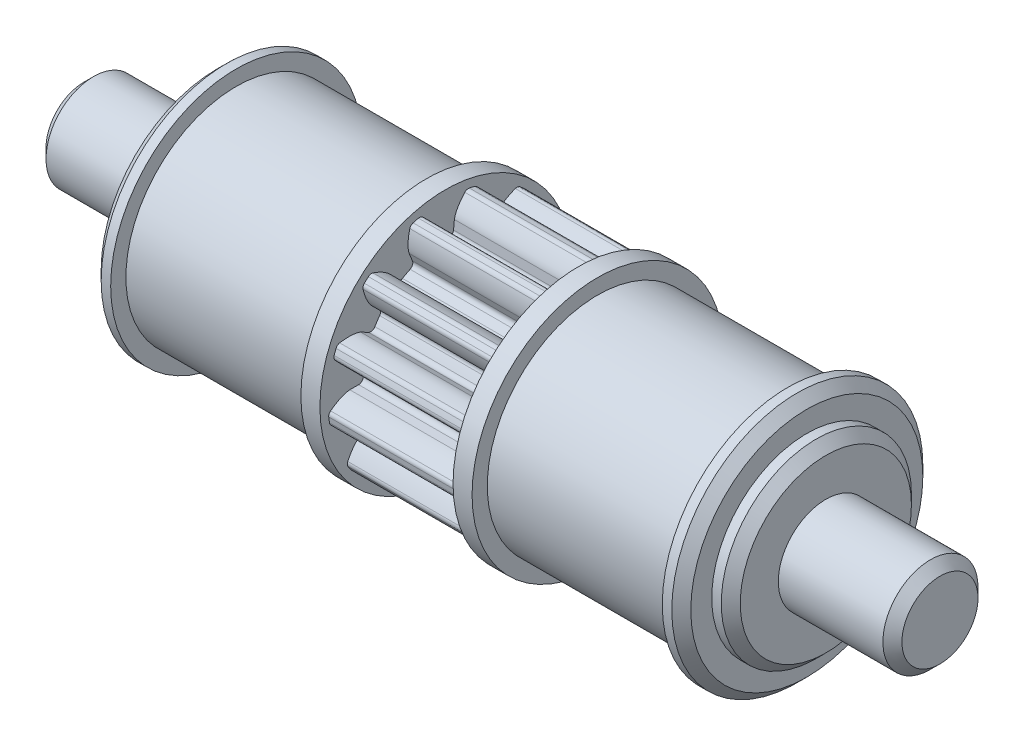
from build123d import *

# Parameters (mm, degrees)
SKETCH2_R                 = 6.173076923
BOSS_EXTRUDE1_DEPTH       = 3.5
CUT_EXTRUDE1_DEPTH        = 12.189895326
CIRPATTERN9_COUNT         = 13
CIRPATTERN9_COPY_1_DEPTH  = 12.189895326
CIRPATTERN9_COPY_2_DEPTH  = 12.189895326
CIRPATTERN9_COPY_3_DEPTH  = 12.189895326
CIRPATTERN9_COPY_4_DEPTH  = 12.189895326
CIRPATTERN9_COPY_5_DEPTH  = 12.189895326
CIRPATTERN9_COPY_6_DEPTH  = 12.189895326
CIRPATTERN9_COPY_7_DEPTH  = 12.189895326
CIRPATTERN9_COPY_8_DEPTH  = 12.189895326
CIRPATTERN9_COPY_9_DEPTH  = 12.189895326
CIRPATTERN9_COPY_10_DEPTH = 12.189895326
CIRPATTERN9_COPY_11_DEPTH = 12.189895326
CIRPATTERN9_COPY_12_DEPTH = 12.189895326
FILLET2_R                 = 0.25
CHAMFER1_SIZE             = 0.5


with BuildPart() as part:
    # Sketch2 → Boss-Extrude1 (new, symmetric)
    with BuildSketch(Plane(origin=(0, 0, 0), x_dir=(0, -1, 0), z_dir=(1, 0, 0))):
        with Locations(Location((0, 0, 0), (0, 0, 90))):
            Circle(SKETCH2_R)
    extrude(amount=BOSS_EXTRUDE1_DEPTH, both=True)

    # Sketch3 → Cut-Extrude1 (cut, through all)
    with BuildSketch(Plane(origin=(3.5, 0, 0), x_dir=(0, 0, -1), z_dir=(1, 0, 0))):
        with BuildLine():
            Line((-5.027355521, 0), (-4.321153846, 0))
            ThreePointArc((-4.321153846, 0), (-4.314936071, 0.231726711), (-4.296300638, 0.462786551))
            Line((-4.296300638, 0.462786551), (-4.998440579, 0.538419275))
            ThreePointArc((-4.998440579, 0.538419275), (-5.020121581, 0.269597566), (-5.027355521, 0))
        make_face()
        with BuildLine():
            add(Edge.make_bspline(
                [(-5.027355521, 0), (-5.031073093, 0), (-5.041497002, -0.000243519), (-5.061180739, -0.001665318), (-5.093196034, -0.005347541), (-5.133783988, -0.012034499), (-5.185909921, -0.022955737), (-5.246793734, -0.038732101), (-5.29520028, -0.053610965), (-5.331198649, -0.065851691), (-5.34926628, -0.072279098), (-5.349510553, -0.072366048)],
                knots=[0, 0, 0, 0, 0, 0.005376748, 0.015083688, 0.02853182, 0.046610139, 0.064854849, 0.092110525, 0.119476175, 0.119851252, 0.119851252, 0.119851252, 0.119851252, 0.119851252], degree=4))
            ThreePointArc((-5.027355521, 0), (-5.020121581, 0.269597566), (-4.998440579, 0.538419275))
            Line((-4.998440579, 0.538419275), (-5.319229361, 0.572973825))
            ThreePointArc((-5.319229361, 0.572973825), (-5.344120014, 0.250761389), (-5.349510553, -0.072366048))
        make_face()
        with BuildLine():
            add(Edge.make_bspline(
                [(-5.349510553, -0.072366048), (-5.367088854, -0.078623129), (-5.402317562, -0.091706249), (-5.454753691, -0.112730929), (-5.523728784, -0.143306198), (-5.591849386, -0.176194748), (-5.673302547, -0.218740215), (-5.769437967, -0.273498951), (-5.879343218, -0.34283121), (-5.993038987, -0.422171313), (-6.075818991, -0.485550668), (-6.127230408, -0.526882857), (-6.148993484, -0.544754837)],
                knots=[0.119851252, 0.119851252, 0.119851252, 0.119851252, 0.119851252, 0.146842495, 0.174208853, 0.201574955, 0.228941013, 0.256307345, 0.307035032, 0.361767351, 0.41649966, 0.457314394, 0.457314394, 0.457314394, 0.457314394, 0.457314394], degree=4))
            ThreePointArc((-5.349510553, -0.072366048), (-5.344120014, 0.250761389), (-5.319229361, 0.572973825))
            Line((-5.319229361, 0.572973825), (-6.13757234, 0.661123644))
            ThreePointArc((-6.13757234, 0.661123644), (-6.172800067, 0.058463967), (-6.148993484, -0.544754837))
        make_face()
    cut_extrude1 = extrude(amount=-CUT_EXTRUDE1_DEPTH, mode=Mode.SUBTRACT)

    # Mirror2: Cut-Extrude1 across plane
    add(cut_extrude1.mirror(Plane(origin=(0, 0, 0), x_dir=(0, 0.10709791121314068, 0.9942484787083067), z_dir=(0, 0.9942484787083068, -0.10709791121314066))), mode=Mode.SUBTRACT)

    # CirPattern9: Cut-Extrude1 ×13 about axis
    cirpattern9_axis = Axis((3.5, 0, 0), (1, 0, 0))
    for i in range(1, CIRPATTERN9_COUNT):
        add(cut_extrude1.rotate(cirpattern9_axis, i * 360 / CIRPATTERN9_COUNT), mode=Mode.SUBTRACT)

    # CirPattern9 copy 1 sketch → CirPattern9 copy 1 (cut, through all)
    with BuildSketch(Plane(origin=(3.5, 0, 0), x_dir=(0, 0.2654923147881811, -0.964112976153943), z_dir=(1, 0, 0))):
        with BuildLine():
            Line((-5.027355521, 0), (-4.321153846, 0))
            ThreePointArc((-4.321153846, 0), (-4.314936071, -0.231726711), (-4.296300638, -0.462786551))
            Line((-4.296300638, -0.462786551), (-4.998440579, -0.538419275))
            ThreePointArc((-4.998440579, -0.538419275), (-5.020121581, -0.269597566), (-5.027355521, 0))
        make_face()
        with BuildLine():
            add(Edge.make_bspline(
                [(-5.027355521, 0), (-5.031073093, 0), (-5.041497002, 0.000243519), (-5.061180739, 0.001665318), (-5.093196034, 0.005347541), (-5.133783988, 0.012034499), (-5.185909921, 0.022955737), (-5.246793734, 0.038732101), (-5.29520028, 0.053610965), (-5.331198649, 0.065851691), (-5.34926628, 0.072279098), (-5.349510553, 0.072366048)],
                knots=[0, 0, 0, 0, 0, 0.005376748, 0.015083688, 0.02853182, 0.046610139, 0.064854849, 0.092110525, 0.119476175, 0.119851252, 0.119851252, 0.119851252, 0.119851252, 0.119851252], degree=4))
            ThreePointArc((-5.027355521, 0), (-5.020121581, -0.269597566), (-4.998440579, -0.538419275))
            Line((-4.998440579, -0.538419275), (-5.319229361, -0.572973825))
            ThreePointArc((-5.319229361, -0.572973825), (-5.344120014, -0.250761389), (-5.349510553, 0.072366048))
        make_face()
        with BuildLine():
            add(Edge.make_bspline(
                [(-5.349510553, 0.072366048), (-5.367088854, 0.078623129), (-5.402317562, 0.091706249), (-5.454753691, 0.112730929), (-5.523728784, 0.143306198), (-5.591849386, 0.176194748), (-5.673302547, 0.218740215), (-5.769437967, 0.273498951), (-5.879343218, 0.34283121), (-5.993038987, 0.422171313), (-6.075818991, 0.485550668), (-6.127230408, 0.526882857), (-6.148993484, 0.544754837)],
                knots=[0.119851252, 0.119851252, 0.119851252, 0.119851252, 0.119851252, 0.146842495, 0.174208853, 0.201574955, 0.228941013, 0.256307345, 0.307035032, 0.361767351, 0.41649966, 0.457314394, 0.457314394, 0.457314394, 0.457314394, 0.457314394], degree=4))
            ThreePointArc((-5.349510553, 0.072366048), (-5.344120014, -0.250761389), (-5.319229361, -0.572973825))
            Line((-5.319229361, -0.572973825), (-6.13757234, -0.661123644))
            ThreePointArc((-6.13757234, -0.661123644), (-6.172800067, -0.058463967), (-6.148993484, 0.544754837))
        make_face()
    extrude(amount=-CIRPATTERN9_COPY_1_DEPTH, mode=Mode.SUBTRACT)

    # CirPattern9 copy 2 sketch → CirPattern9 copy 2 (cut, through all)
    with BuildSketch(Plane(origin=(3.5, 0, 0), x_dir=(0, 0.6831274103806323, -0.7302992134643521), z_dir=(1, 0, 0))):
        with BuildLine():
            Line((-5.027355521, 0), (-4.321153846, 0))
            ThreePointArc((-4.321153846, 0), (-4.314936071, -0.231726711), (-4.296300638, -0.462786551))
            Line((-4.296300638, -0.462786551), (-4.998440579, -0.538419275))
            ThreePointArc((-4.998440579, -0.538419275), (-5.020121581, -0.269597566), (-5.027355521, 0))
        make_face()
        with BuildLine():
            add(Edge.make_bspline(
                [(-5.027355521, 0), (-5.031073093, 0), (-5.041497002, 0.000243519), (-5.061180739, 0.001665318), (-5.093196034, 0.005347541), (-5.133783988, 0.012034499), (-5.185909921, 0.022955737), (-5.246793734, 0.038732101), (-5.29520028, 0.053610965), (-5.331198649, 0.065851691), (-5.34926628, 0.072279098), (-5.349510553, 0.072366048)],
                knots=[0, 0, 0, 0, 0, 0.005376748, 0.015083688, 0.02853182, 0.046610139, 0.064854849, 0.092110525, 0.119476175, 0.119851252, 0.119851252, 0.119851252, 0.119851252, 0.119851252], degree=4))
            ThreePointArc((-5.027355521, 0), (-5.020121581, -0.269597566), (-4.998440579, -0.538419275))
            Line((-4.998440579, -0.538419275), (-5.319229361, -0.572973825))
            ThreePointArc((-5.319229361, -0.572973825), (-5.344120014, -0.250761389), (-5.349510553, 0.072366048))
        make_face()
        with BuildLine():
            add(Edge.make_bspline(
                [(-5.349510553, 0.072366048), (-5.367088854, 0.078623129), (-5.402317562, 0.091706249), (-5.454753691, 0.112730929), (-5.523728784, 0.143306198), (-5.591849386, 0.176194748), (-5.673302547, 0.218740215), (-5.769437967, 0.273498951), (-5.879343218, 0.34283121), (-5.993038987, 0.422171313), (-6.075818991, 0.485550668), (-6.127230408, 0.526882857), (-6.148993484, 0.544754837)],
                knots=[0.119851252, 0.119851252, 0.119851252, 0.119851252, 0.119851252, 0.146842495, 0.174208853, 0.201574955, 0.228941013, 0.256307345, 0.307035032, 0.361767351, 0.41649966, 0.457314394, 0.457314394, 0.457314394, 0.457314394, 0.457314394], degree=4))
            ThreePointArc((-5.349510553, 0.072366048), (-5.344120014, -0.250761389), (-5.319229361, -0.572973825))
            Line((-5.319229361, -0.572973825), (-6.13757234, -0.661123644))
            ThreePointArc((-6.13757234, -0.661123644), (-6.172800067, -0.058463967), (-6.148993484, 0.544754837))
        make_face()
    extrude(amount=-CIRPATTERN9_COPY_2_DEPTH, mode=Mode.SUBTRACT)

    # CirPattern9 copy 3 sketch → CirPattern9 copy 3 (cut, through all)
    with BuildSketch(Plane(origin=(3.5, 0, 0), x_dir=(0, 0.9442662488326269, -0.32918270202967764), z_dir=(1, 0, 0))):
        with BuildLine():
            Line((-5.027355521, 0), (-4.321153846, 0))
            ThreePointArc((-4.321153846, 0), (-4.314936071, -0.231726711), (-4.296300638, -0.462786551))
            Line((-4.296300638, -0.462786551), (-4.998440579, -0.538419275))
            ThreePointArc((-4.998440579, -0.538419275), (-5.020121581, -0.269597566), (-5.027355521, 0))
        make_face()
        with BuildLine():
            add(Edge.make_bspline(
                [(-5.027355521, 0), (-5.031073093, 0), (-5.041497002, 0.000243519), (-5.061180739, 0.001665318), (-5.093196034, 0.005347541), (-5.133783988, 0.012034499), (-5.185909921, 0.022955737), (-5.246793734, 0.038732101), (-5.29520028, 0.053610965), (-5.331198649, 0.065851691), (-5.34926628, 0.072279098), (-5.349510553, 0.072366048)],
                knots=[0, 0, 0, 0, 0, 0.005376748, 0.015083688, 0.02853182, 0.046610139, 0.064854849, 0.092110525, 0.119476175, 0.119851252, 0.119851252, 0.119851252, 0.119851252, 0.119851252], degree=4))
            ThreePointArc((-5.027355521, 0), (-5.020121581, -0.269597566), (-4.998440579, -0.538419275))
            Line((-4.998440579, -0.538419275), (-5.319229361, -0.572973825))
            ThreePointArc((-5.319229361, -0.572973825), (-5.344120014, -0.250761389), (-5.349510553, 0.072366048))
        make_face()
        with BuildLine():
            add(Edge.make_bspline(
                [(-5.349510553, 0.072366048), (-5.367088854, 0.078623129), (-5.402317562, 0.091706249), (-5.454753691, 0.112730929), (-5.523728784, 0.143306198), (-5.591849386, 0.176194748), (-5.673302547, 0.218740215), (-5.769437967, 0.273498951), (-5.879343218, 0.34283121), (-5.993038987, 0.422171313), (-6.075818991, 0.485550668), (-6.127230408, 0.526882857), (-6.148993484, 0.544754837)],
                knots=[0.119851252, 0.119851252, 0.119851252, 0.119851252, 0.119851252, 0.146842495, 0.174208853, 0.201574955, 0.228941013, 0.256307345, 0.307035032, 0.361767351, 0.41649966, 0.457314394, 0.457314394, 0.457314394, 0.457314394, 0.457314394], degree=4))
            ThreePointArc((-5.349510553, 0.072366048), (-5.344120014, -0.250761389), (-5.319229361, -0.572973825))
            Line((-5.319229361, -0.572973825), (-6.13757234, -0.661123644))
            ThreePointArc((-6.13757234, -0.661123644), (-6.172800067, -0.058463967), (-6.148993484, 0.544754837))
        make_face()
    extrude(amount=-CIRPATTERN9_COPY_3_DEPTH, mode=Mode.SUBTRACT)

    # CirPattern9 copy 4 sketch → CirPattern9 copy 4 (cut, through all)
    with BuildSketch(Plane(origin=(3.5, 0, 0), x_dir=(0, 0.9890850693189733, 0.14734559935838568), z_dir=(1, 0, 0))):
        with BuildLine():
            Line((-5.027355521, 0), (-4.321153846, 0))
            ThreePointArc((-4.321153846, 0), (-4.314936071, -0.231726711), (-4.296300638, -0.462786551))
            Line((-4.296300638, -0.462786551), (-4.998440579, -0.538419275))
            ThreePointArc((-4.998440579, -0.538419275), (-5.020121581, -0.269597566), (-5.027355521, 0))
        make_face()
        with BuildLine():
            add(Edge.make_bspline(
                [(-5.027355521, 0), (-5.031073093, 0), (-5.041497002, 0.000243519), (-5.061180739, 0.001665318), (-5.093196034, 0.005347541), (-5.133783988, 0.012034499), (-5.185909921, 0.022955737), (-5.246793734, 0.038732101), (-5.29520028, 0.053610965), (-5.331198649, 0.065851691), (-5.34926628, 0.072279098), (-5.349510553, 0.072366048)],
                knots=[0, 0, 0, 0, 0, 0.005376748, 0.015083688, 0.02853182, 0.046610139, 0.064854849, 0.092110525, 0.119476175, 0.119851252, 0.119851252, 0.119851252, 0.119851252, 0.119851252], degree=4))
            ThreePointArc((-5.027355521, 0), (-5.020121581, -0.269597566), (-4.998440579, -0.538419275))
            Line((-4.998440579, -0.538419275), (-5.319229361, -0.572973825))
            ThreePointArc((-5.319229361, -0.572973825), (-5.344120014, -0.250761389), (-5.349510553, 0.072366048))
        make_face()
        with BuildLine():
            add(Edge.make_bspline(
                [(-5.349510553, 0.072366048), (-5.367088854, 0.078623129), (-5.402317562, 0.091706249), (-5.454753691, 0.112730929), (-5.523728784, 0.143306198), (-5.591849386, 0.176194748), (-5.673302547, 0.218740215), (-5.769437967, 0.273498951), (-5.879343218, 0.34283121), (-5.993038987, 0.422171313), (-6.075818991, 0.485550668), (-6.127230408, 0.526882857), (-6.148993484, 0.544754837)],
                knots=[0.119851252, 0.119851252, 0.119851252, 0.119851252, 0.119851252, 0.146842495, 0.174208853, 0.201574955, 0.228941013, 0.256307345, 0.307035032, 0.361767351, 0.41649966, 0.457314394, 0.457314394, 0.457314394, 0.457314394, 0.457314394], degree=4))
            ThreePointArc((-5.349510553, 0.072366048), (-5.344120014, -0.250761389), (-5.319229361, -0.572973825))
            Line((-5.319229361, -0.572973825), (-6.13757234, -0.661123644))
            ThreePointArc((-6.13757234, -0.661123644), (-6.172800067, -0.058463967), (-6.148993484, 0.544754837))
        make_face()
    extrude(amount=-CIRPATTERN9_COPY_4_DEPTH, mode=Mode.SUBTRACT)

    # CirPattern9 copy 5 sketch → CirPattern9 copy 5 (cut, through all)
    with BuildSketch(Plane(origin=(3.5, 0, 0), x_dir=(0, 0.8073164201915888, 0.59011879964041), z_dir=(1, 0, 0))):
        with BuildLine():
            Line((-5.027355521, 0), (-4.321153846, 0))
            ThreePointArc((-4.321153846, 0), (-4.314936071, -0.231726711), (-4.296300638, -0.462786551))
            Line((-4.296300638, -0.462786551), (-4.998440579, -0.538419275))
            ThreePointArc((-4.998440579, -0.538419275), (-5.020121581, -0.269597566), (-5.027355521, 0))
        make_face()
        with BuildLine():
            add(Edge.make_bspline(
                [(-5.027355521, 0), (-5.031073093, 0), (-5.041497002, 0.000243519), (-5.061180739, 0.001665318), (-5.093196034, 0.005347541), (-5.133783988, 0.012034499), (-5.185909921, 0.022955737), (-5.246793734, 0.038732101), (-5.29520028, 0.053610965), (-5.331198649, 0.065851691), (-5.34926628, 0.072279098), (-5.349510553, 0.072366048)],
                knots=[0, 0, 0, 0, 0, 0.005376748, 0.015083688, 0.02853182, 0.046610139, 0.064854849, 0.092110525, 0.119476175, 0.119851252, 0.119851252, 0.119851252, 0.119851252, 0.119851252], degree=4))
            ThreePointArc((-5.027355521, 0), (-5.020121581, -0.269597566), (-4.998440579, -0.538419275))
            Line((-4.998440579, -0.538419275), (-5.319229361, -0.572973825))
            ThreePointArc((-5.319229361, -0.572973825), (-5.344120014, -0.250761389), (-5.349510553, 0.072366048))
        make_face()
        with BuildLine():
            add(Edge.make_bspline(
                [(-5.349510553, 0.072366048), (-5.367088854, 0.078623129), (-5.402317562, 0.091706249), (-5.454753691, 0.112730929), (-5.523728784, 0.143306198), (-5.591849386, 0.176194748), (-5.673302547, 0.218740215), (-5.769437967, 0.273498951), (-5.879343218, 0.34283121), (-5.993038987, 0.422171313), (-6.075818991, 0.485550668), (-6.127230408, 0.526882857), (-6.148993484, 0.544754837)],
                knots=[0.119851252, 0.119851252, 0.119851252, 0.119851252, 0.119851252, 0.146842495, 0.174208853, 0.201574955, 0.228941013, 0.256307345, 0.307035032, 0.361767351, 0.41649966, 0.457314394, 0.457314394, 0.457314394, 0.457314394, 0.457314394], degree=4))
            ThreePointArc((-5.349510553, 0.072366048), (-5.344120014, -0.250761389), (-5.319229361, -0.572973825))
            Line((-5.319229361, -0.572973825), (-6.13757234, -0.661123644))
            ThreePointArc((-6.13757234, -0.661123644), (-6.172800067, -0.058463967), (-6.148993484, 0.544754837))
        make_face()
    extrude(amount=-CIRPATTERN9_COPY_5_DEPTH, mode=Mode.SUBTRACT)

    # CirPattern9 copy 6 sketch → CirPattern9 copy 6 (cut, through all)
    with BuildSketch(Plane(origin=(3.5, 0, 0), x_dir=(0, 0.4406013084158681, 0.8977028946272955), z_dir=(1, 0, 0))):
        with BuildLine():
            Line((-5.027355521, 0), (-4.321153846, 0))
            ThreePointArc((-4.321153846, 0), (-4.314936071, -0.231726711), (-4.296300638, -0.462786551))
            Line((-4.296300638, -0.462786551), (-4.998440579, -0.538419275))
            ThreePointArc((-4.998440579, -0.538419275), (-5.020121581, -0.269597566), (-5.027355521, 0))
        make_face()
        with BuildLine():
            add(Edge.make_bspline(
                [(-5.027355521, 0), (-5.031073093, 0), (-5.041497002, 0.000243519), (-5.061180739, 0.001665318), (-5.093196034, 0.005347541), (-5.133783988, 0.012034499), (-5.185909921, 0.022955737), (-5.246793734, 0.038732101), (-5.29520028, 0.053610965), (-5.331198649, 0.065851691), (-5.34926628, 0.072279098), (-5.349510553, 0.072366048)],
                knots=[0, 0, 0, 0, 0, 0.005376748, 0.015083688, 0.02853182, 0.046610139, 0.064854849, 0.092110525, 0.119476175, 0.119851252, 0.119851252, 0.119851252, 0.119851252, 0.119851252], degree=4))
            ThreePointArc((-5.027355521, 0), (-5.020121581, -0.269597566), (-4.998440579, -0.538419275))
            Line((-4.998440579, -0.538419275), (-5.319229361, -0.572973825))
            ThreePointArc((-5.319229361, -0.572973825), (-5.344120014, -0.250761389), (-5.349510553, 0.072366048))
        make_face()
        with BuildLine():
            add(Edge.make_bspline(
                [(-5.349510553, 0.072366048), (-5.367088854, 0.078623129), (-5.402317562, 0.091706249), (-5.454753691, 0.112730929), (-5.523728784, 0.143306198), (-5.591849386, 0.176194748), (-5.673302547, 0.218740215), (-5.769437967, 0.273498951), (-5.879343218, 0.34283121), (-5.993038987, 0.422171313), (-6.075818991, 0.485550668), (-6.127230408, 0.526882857), (-6.148993484, 0.544754837)],
                knots=[0.119851252, 0.119851252, 0.119851252, 0.119851252, 0.119851252, 0.146842495, 0.174208853, 0.201574955, 0.228941013, 0.256307345, 0.307035032, 0.361767351, 0.41649966, 0.457314394, 0.457314394, 0.457314394, 0.457314394, 0.457314394], degree=4))
            ThreePointArc((-5.349510553, 0.072366048), (-5.344120014, -0.250761389), (-5.319229361, -0.572973825))
            Line((-5.319229361, -0.572973825), (-6.13757234, -0.661123644))
            ThreePointArc((-6.13757234, -0.661123644), (-6.172800067, -0.058463967), (-6.148993484, 0.544754837))
        make_face()
    extrude(amount=-CIRPATTERN9_COPY_6_DEPTH, mode=Mode.SUBTRACT)

    # CirPattern9 copy 7 sketch → CirPattern9 copy 7 (cut, through all)
    with BuildSketch(Plane(origin=(3.5, 0, 0), x_dir=(0, -0.027050253296550947, 0.9996340749477244), z_dir=(1, 0, 0))):
        with BuildLine():
            Line((-5.027355521, 0), (-4.321153846, 0))
            ThreePointArc((-4.321153846, 0), (-4.314936071, -0.231726711), (-4.296300638, -0.462786551))
            Line((-4.296300638, -0.462786551), (-4.998440579, -0.538419275))
            ThreePointArc((-4.998440579, -0.538419275), (-5.020121581, -0.269597566), (-5.027355521, 0))
        make_face()
        with BuildLine():
            add(Edge.make_bspline(
                [(-5.027355521, 0), (-5.031073093, 0), (-5.041497002, 0.000243519), (-5.061180739, 0.001665318), (-5.093196034, 0.005347541), (-5.133783988, 0.012034499), (-5.185909921, 0.022955737), (-5.246793734, 0.038732101), (-5.29520028, 0.053610965), (-5.331198649, 0.065851691), (-5.34926628, 0.072279098), (-5.349510553, 0.072366048)],
                knots=[0, 0, 0, 0, 0, 0.005376748, 0.015083688, 0.02853182, 0.046610139, 0.064854849, 0.092110525, 0.119476175, 0.119851252, 0.119851252, 0.119851252, 0.119851252, 0.119851252], degree=4))
            ThreePointArc((-5.027355521, 0), (-5.020121581, -0.269597566), (-4.998440579, -0.538419275))
            Line((-4.998440579, -0.538419275), (-5.319229361, -0.572973825))
            ThreePointArc((-5.319229361, -0.572973825), (-5.344120014, -0.250761389), (-5.349510553, 0.072366048))
        make_face()
        with BuildLine():
            add(Edge.make_bspline(
                [(-5.349510553, 0.072366048), (-5.367088854, 0.078623129), (-5.402317562, 0.091706249), (-5.454753691, 0.112730929), (-5.523728784, 0.143306198), (-5.591849386, 0.176194748), (-5.673302547, 0.218740215), (-5.769437967, 0.273498951), (-5.879343218, 0.34283121), (-5.993038987, 0.422171313), (-6.075818991, 0.485550668), (-6.127230408, 0.526882857), (-6.148993484, 0.544754837)],
                knots=[0.119851252, 0.119851252, 0.119851252, 0.119851252, 0.119851252, 0.146842495, 0.174208853, 0.201574955, 0.228941013, 0.256307345, 0.307035032, 0.361767351, 0.41649966, 0.457314394, 0.457314394, 0.457314394, 0.457314394, 0.457314394], degree=4))
            ThreePointArc((-5.349510553, 0.072366048), (-5.344120014, -0.250761389), (-5.319229361, -0.572973825))
            Line((-5.319229361, -0.572973825), (-6.13757234, -0.661123644))
            ThreePointArc((-6.13757234, -0.661123644), (-6.172800067, -0.058463967), (-6.148993484, 0.544754837))
        make_face()
    extrude(amount=-CIRPATTERN9_COPY_7_DEPTH, mode=Mode.SUBTRACT)

    # CirPattern9 copy 8 sketch → CirPattern9 copy 8 (cut, through all)
    with BuildSketch(Plane(origin=(3.5, 0, 0), x_dir=(0, -0.4885049279696214, 0.8725611355941744), z_dir=(1, 0, 0))):
        with BuildLine():
            Line((-5.027355521, 0), (-4.321153846, 0))
            ThreePointArc((-4.321153846, 0), (-4.314936071, -0.231726711), (-4.296300638, -0.462786551))
            Line((-4.296300638, -0.462786551), (-4.998440579, -0.538419275))
            ThreePointArc((-4.998440579, -0.538419275), (-5.020121581, -0.269597566), (-5.027355521, 0))
        make_face()
        with BuildLine():
            add(Edge.make_bspline(
                [(-5.027355521, 0), (-5.031073093, 0), (-5.041497002, 0.000243519), (-5.061180739, 0.001665318), (-5.093196034, 0.005347541), (-5.133783988, 0.012034499), (-5.185909921, 0.022955737), (-5.246793734, 0.038732101), (-5.29520028, 0.053610965), (-5.331198649, 0.065851691), (-5.34926628, 0.072279098), (-5.349510553, 0.072366048)],
                knots=[0, 0, 0, 0, 0, 0.005376748, 0.015083688, 0.02853182, 0.046610139, 0.064854849, 0.092110525, 0.119476175, 0.119851252, 0.119851252, 0.119851252, 0.119851252, 0.119851252], degree=4))
            ThreePointArc((-5.027355521, 0), (-5.020121581, -0.269597566), (-4.998440579, -0.538419275))
            Line((-4.998440579, -0.538419275), (-5.319229361, -0.572973825))
            ThreePointArc((-5.319229361, -0.572973825), (-5.344120014, -0.250761389), (-5.349510553, 0.072366048))
        make_face()
        with BuildLine():
            add(Edge.make_bspline(
                [(-5.349510553, 0.072366048), (-5.367088854, 0.078623129), (-5.402317562, 0.091706249), (-5.454753691, 0.112730929), (-5.523728784, 0.143306198), (-5.591849386, 0.176194748), (-5.673302547, 0.218740215), (-5.769437967, 0.273498951), (-5.879343218, 0.34283121), (-5.993038987, 0.422171313), (-6.075818991, 0.485550668), (-6.127230408, 0.526882857), (-6.148993484, 0.544754837)],
                knots=[0.119851252, 0.119851252, 0.119851252, 0.119851252, 0.119851252, 0.146842495, 0.174208853, 0.201574955, 0.228941013, 0.256307345, 0.307035032, 0.361767351, 0.41649966, 0.457314394, 0.457314394, 0.457314394, 0.457314394, 0.457314394], degree=4))
            ThreePointArc((-5.349510553, 0.072366048), (-5.344120014, -0.250761389), (-5.319229361, -0.572973825))
            Line((-5.319229361, -0.572973825), (-6.13757234, -0.661123644))
            ThreePointArc((-6.13757234, -0.661123644), (-6.172800067, -0.058463967), (-6.148993484, 0.544754837))
        make_face()
    extrude(amount=-CIRPATTERN9_COPY_8_DEPTH, mode=Mode.SUBTRACT)

    # CirPattern9 copy 9 sketch → CirPattern9 copy 9 (cut, through all)
    with BuildSketch(Plane(origin=(3.5, 0, 0), x_dir=(0, -0.8380490107674259, 0.5455949555776145), z_dir=(1, 0, 0))):
        with BuildLine():
            Line((-5.027355521, 0), (-4.321153846, 0))
            ThreePointArc((-4.321153846, 0), (-4.314936071, -0.231726711), (-4.296300638, -0.462786551))
            Line((-4.296300638, -0.462786551), (-4.998440579, -0.538419275))
            ThreePointArc((-4.998440579, -0.538419275), (-5.020121581, -0.269597566), (-5.027355521, 0))
        make_face()
        with BuildLine():
            add(Edge.make_bspline(
                [(-5.027355521, 0), (-5.031073093, 0), (-5.041497002, 0.000243519), (-5.061180739, 0.001665318), (-5.093196034, 0.005347541), (-5.133783988, 0.012034499), (-5.185909921, 0.022955737), (-5.246793734, 0.038732101), (-5.29520028, 0.053610965), (-5.331198649, 0.065851691), (-5.34926628, 0.072279098), (-5.349510553, 0.072366048)],
                knots=[0, 0, 0, 0, 0, 0.005376748, 0.015083688, 0.02853182, 0.046610139, 0.064854849, 0.092110525, 0.119476175, 0.119851252, 0.119851252, 0.119851252, 0.119851252, 0.119851252], degree=4))
            ThreePointArc((-5.027355521, 0), (-5.020121581, -0.269597566), (-4.998440579, -0.538419275))
            Line((-4.998440579, -0.538419275), (-5.319229361, -0.572973825))
            ThreePointArc((-5.319229361, -0.572973825), (-5.344120014, -0.250761389), (-5.349510553, 0.072366048))
        make_face()
        with BuildLine():
            add(Edge.make_bspline(
                [(-5.349510553, 0.072366048), (-5.367088854, 0.078623129), (-5.402317562, 0.091706249), (-5.454753691, 0.112730929), (-5.523728784, 0.143306198), (-5.591849386, 0.176194748), (-5.673302547, 0.218740215), (-5.769437967, 0.273498951), (-5.879343218, 0.34283121), (-5.993038987, 0.422171313), (-6.075818991, 0.485550668), (-6.127230408, 0.526882857), (-6.148993484, 0.544754837)],
                knots=[0.119851252, 0.119851252, 0.119851252, 0.119851252, 0.119851252, 0.146842495, 0.174208853, 0.201574955, 0.228941013, 0.256307345, 0.307035032, 0.361767351, 0.41649966, 0.457314394, 0.457314394, 0.457314394, 0.457314394, 0.457314394], degree=4))
            ThreePointArc((-5.349510553, 0.072366048), (-5.344120014, -0.250761389), (-5.319229361, -0.572973825))
            Line((-5.319229361, -0.572973825), (-6.13757234, -0.661123644))
            ThreePointArc((-6.13757234, -0.661123644), (-6.172800067, -0.058463967), (-6.148993484, 0.544754837))
        make_face()
    extrude(amount=-CIRPATTERN9_COPY_9_DEPTH, mode=Mode.SUBTRACT)

    # CirPattern9 copy 10 sketch → CirPattern9 copy 10 (cut, through all)
    with BuildSketch(Plane(origin=(3.5, 0, 0), x_dir=(0, -0.9956061647838369, 0.09363954637021406), z_dir=(1, 0, 0))):
        with BuildLine():
            Line((-5.027355521, 0), (-4.321153846, 0))
            ThreePointArc((-4.321153846, 0), (-4.314936071, -0.231726711), (-4.296300638, -0.462786551))
            Line((-4.296300638, -0.462786551), (-4.998440579, -0.538419275))
            ThreePointArc((-4.998440579, -0.538419275), (-5.020121581, -0.269597566), (-5.027355521, 0))
        make_face()
        with BuildLine():
            add(Edge.make_bspline(
                [(-5.027355521, 0), (-5.031073093, 0), (-5.041497002, 0.000243519), (-5.061180739, 0.001665318), (-5.093196034, 0.005347541), (-5.133783988, 0.012034499), (-5.185909921, 0.022955737), (-5.246793734, 0.038732101), (-5.29520028, 0.053610965), (-5.331198649, 0.065851691), (-5.34926628, 0.072279098), (-5.349510553, 0.072366048)],
                knots=[0, 0, 0, 0, 0, 0.005376748, 0.015083688, 0.02853182, 0.046610139, 0.064854849, 0.092110525, 0.119476175, 0.119851252, 0.119851252, 0.119851252, 0.119851252, 0.119851252], degree=4))
            ThreePointArc((-5.027355521, 0), (-5.020121581, -0.269597566), (-4.998440579, -0.538419275))
            Line((-4.998440579, -0.538419275), (-5.319229361, -0.572973825))
            ThreePointArc((-5.319229361, -0.572973825), (-5.344120014, -0.250761389), (-5.349510553, 0.072366048))
        make_face()
        with BuildLine():
            add(Edge.make_bspline(
                [(-5.349510553, 0.072366048), (-5.367088854, 0.078623129), (-5.402317562, 0.091706249), (-5.454753691, 0.112730929), (-5.523728784, 0.143306198), (-5.591849386, 0.176194748), (-5.673302547, 0.218740215), (-5.769437967, 0.273498951), (-5.879343218, 0.34283121), (-5.993038987, 0.422171313), (-6.075818991, 0.485550668), (-6.127230408, 0.526882857), (-6.148993484, 0.544754837)],
                knots=[0.119851252, 0.119851252, 0.119851252, 0.119851252, 0.119851252, 0.146842495, 0.174208853, 0.201574955, 0.228941013, 0.256307345, 0.307035032, 0.361767351, 0.41649966, 0.457314394, 0.457314394, 0.457314394, 0.457314394, 0.457314394], degree=4))
            ThreePointArc((-5.349510553, 0.072366048), (-5.344120014, -0.250761389), (-5.319229361, -0.572973825))
            Line((-5.319229361, -0.572973825), (-6.13757234, -0.661123644))
            ThreePointArc((-6.13757234, -0.661123644), (-6.172800067, -0.058463967), (-6.148993484, 0.544754837))
        make_face()
    extrude(amount=-CIRPATTERN9_COPY_10_DEPTH, mode=Mode.SUBTRACT)

    # CirPattern9 copy 11 sketch → CirPattern9 copy 11 (cut, through all)
    with BuildSketch(Plane(origin=(3.5, 0, 0), x_dir=(0, -0.9250819448032359, -0.3797675544317376), z_dir=(1, 0, 0))):
        with BuildLine():
            Line((-5.027355521, 0), (-4.321153846, 0))
            ThreePointArc((-4.321153846, 0), (-4.314936071, -0.231726711), (-4.296300638, -0.462786551))
            Line((-4.296300638, -0.462786551), (-4.998440579, -0.538419275))
            ThreePointArc((-4.998440579, -0.538419275), (-5.020121581, -0.269597566), (-5.027355521, 0))
        make_face()
        with BuildLine():
            add(Edge.make_bspline(
                [(-5.027355521, 0), (-5.031073093, 0), (-5.041497002, 0.000243519), (-5.061180739, 0.001665318), (-5.093196034, 0.005347541), (-5.133783988, 0.012034499), (-5.185909921, 0.022955737), (-5.246793734, 0.038732101), (-5.29520028, 0.053610965), (-5.331198649, 0.065851691), (-5.34926628, 0.072279098), (-5.349510553, 0.072366048)],
                knots=[0, 0, 0, 0, 0, 0.005376748, 0.015083688, 0.02853182, 0.046610139, 0.064854849, 0.092110525, 0.119476175, 0.119851252, 0.119851252, 0.119851252, 0.119851252, 0.119851252], degree=4))
            ThreePointArc((-5.027355521, 0), (-5.020121581, -0.269597566), (-4.998440579, -0.538419275))
            Line((-4.998440579, -0.538419275), (-5.319229361, -0.572973825))
            ThreePointArc((-5.319229361, -0.572973825), (-5.344120014, -0.250761389), (-5.349510553, 0.072366048))
        make_face()
        with BuildLine():
            add(Edge.make_bspline(
                [(-5.349510553, 0.072366048), (-5.367088854, 0.078623129), (-5.402317562, 0.091706249), (-5.454753691, 0.112730929), (-5.523728784, 0.143306198), (-5.591849386, 0.176194748), (-5.673302547, 0.218740215), (-5.769437967, 0.273498951), (-5.879343218, 0.34283121), (-5.993038987, 0.422171313), (-6.075818991, 0.485550668), (-6.127230408, 0.526882857), (-6.148993484, 0.544754837)],
                knots=[0.119851252, 0.119851252, 0.119851252, 0.119851252, 0.119851252, 0.146842495, 0.174208853, 0.201574955, 0.228941013, 0.256307345, 0.307035032, 0.361767351, 0.41649966, 0.457314394, 0.457314394, 0.457314394, 0.457314394, 0.457314394], degree=4))
            ThreePointArc((-5.349510553, 0.072366048), (-5.344120014, -0.250761389), (-5.319229361, -0.572973825))
            Line((-5.319229361, -0.572973825), (-6.13757234, -0.661123644))
            ThreePointArc((-6.13757234, -0.661123644), (-6.172800067, -0.058463967), (-6.148993484, 0.544754837))
        make_face()
    extrude(amount=-CIRPATTERN9_COPY_11_DEPTH, mode=Mode.SUBTRACT)

    # CirPattern9 copy 12 sketch → CirPattern9 copy 12 (cut, through all)
    with BuildSketch(Plane(origin=(3.5, 0, 0), x_dir=(0, -0.6426325997141941, -0.7661744852085435), z_dir=(1, 0, 0))):
        with BuildLine():
            Line((-5.027355521, 0), (-4.321153846, 0))
            ThreePointArc((-4.321153846, 0), (-4.314936071, -0.231726711), (-4.296300638, -0.462786551))
            Line((-4.296300638, -0.462786551), (-4.998440579, -0.538419275))
            ThreePointArc((-4.998440579, -0.538419275), (-5.020121581, -0.269597566), (-5.027355521, 0))
        make_face()
        with BuildLine():
            add(Edge.make_bspline(
                [(-5.027355521, 0), (-5.031073093, 0), (-5.041497002, 0.000243519), (-5.061180739, 0.001665318), (-5.093196034, 0.005347541), (-5.133783988, 0.012034499), (-5.185909921, 0.022955737), (-5.246793734, 0.038732101), (-5.29520028, 0.053610965), (-5.331198649, 0.065851691), (-5.34926628, 0.072279098), (-5.349510553, 0.072366048)],
                knots=[0, 0, 0, 0, 0, 0.005376748, 0.015083688, 0.02853182, 0.046610139, 0.064854849, 0.092110525, 0.119476175, 0.119851252, 0.119851252, 0.119851252, 0.119851252, 0.119851252], degree=4))
            ThreePointArc((-5.027355521, 0), (-5.020121581, -0.269597566), (-4.998440579, -0.538419275))
            Line((-4.998440579, -0.538419275), (-5.319229361, -0.572973825))
            ThreePointArc((-5.319229361, -0.572973825), (-5.344120014, -0.250761389), (-5.349510553, 0.072366048))
        make_face()
        with BuildLine():
            add(Edge.make_bspline(
                [(-5.349510553, 0.072366048), (-5.367088854, 0.078623129), (-5.402317562, 0.091706249), (-5.454753691, 0.112730929), (-5.523728784, 0.143306198), (-5.591849386, 0.176194748), (-5.673302547, 0.218740215), (-5.769437967, 0.273498951), (-5.879343218, 0.34283121), (-5.993038987, 0.422171313), (-6.075818991, 0.485550668), (-6.127230408, 0.526882857), (-6.148993484, 0.544754837)],
                knots=[0.119851252, 0.119851252, 0.119851252, 0.119851252, 0.119851252, 0.146842495, 0.174208853, 0.201574955, 0.228941013, 0.256307345, 0.307035032, 0.361767351, 0.41649966, 0.457314394, 0.457314394, 0.457314394, 0.457314394, 0.457314394], degree=4))
            ThreePointArc((-5.349510553, 0.072366048), (-5.344120014, -0.250761389), (-5.319229361, -0.572973825))
            Line((-5.319229361, -0.572973825), (-6.13757234, -0.661123644))
            ThreePointArc((-6.13757234, -0.661123644), (-6.172800067, -0.058463967), (-6.148993484, 0.544754837))
        make_face()
    extrude(amount=-CIRPATTERN9_COPY_12_DEPTH, mode=Mode.SUBTRACT)

    # Fillet2
    fillet2_edges = [part.edges().sort_by_distance(p)[0] for p in [
        (0, -5.285653478, -3.188847129),
        (0, -3.488538454, -2.549994121),
        (0, -0.544754837, 6.148993484),
        (0, 0, 4.321153846),
        (0, -3.198282569, -5.279949555),
        (0, -1.903906038, -3.879112316),
        (0, -0.378223667, -6.16147917),
        (0, 0.116888306, -4.319572628),
        (0, 2.528481719, -5.63148816),
        (0, 2.110904948, -3.770470907),
        (0, 4.855942415, -3.811391079),
        (0, 3.621338706, -2.357599741),
        (0, 6.070965224, -1.118150235),
        (0, 4.302167408, -0.404630886),
        (0, 5.895203063, 1.831245353),
        (0, 3.997421404, 1.641034028),
        (0, 4.368920925, 4.3611247),
        (0, 2.77691433, 3.310757824),
        (0, 1.841771655, 5.891922935),
        (0, 0.920249649, 4.2220269),
        (0, -5.369978447, 3.044701984),
        (0, -3.556239897, 2.454695165),
        (0, -6.169823338, 0.2003963),
        (0, -4.289647769, 0.520857539),
        (0, -5.556236056, -2.689817761),
        (0, -4.040349033, -1.532302272),
        (0, -3.669782054, -4.963826989),
        (0, -2.865455025, -3.234430098),
        (0, -0.942625208, -6.100683274),
        (0, -1.034119803, -4.195588969),
        (0, 2.000475712, -5.839946543),
        (0, 1.034119803, -4.195588969),
        (0, 4.485291755, -4.241348437),
        (0, 2.865455025, -3.234430098),
        (0, 5.942581511, -1.671108519),
        (0, 4.040349033, -1.532302272),
        (0, 6.038497459, 1.281962223),
        (0, 4.289647769, 0.520857539),
        (0, 4.75106641, 3.941350868),
        (0, 3.556239897, 2.454695165),
        (0, 2.375223304, 5.697823528),
        (0, 2.008140322, 3.826191711),
        (0, -3.33993621, 5.191503136),
        (0, -2.008140322, 3.826191711),
        (0, -1.107305306, 6.072952631),
        (0, -1.147233137, 4.166080495),
        (0, -3.802711966, 4.862742066),
        (0, -2.951898637, 3.155735255),
        (0, -5.626963142, 2.538535897),
        (0, -4.080319733, 1.422449099),
        (0, -6.162144874, -0.367218254),
        (0, -4.273988751, -0.636703003),
    ]]
    fillet(fillet2_edges, radius=FILLET2_R)

    # Sketch4 → Revolve1 (revolve)
    with BuildSketch(Plane.XY, mode=Mode.PRIVATE) as revolve1_sk:
        Polygon((3.5, 0), (3.5, 6.6), (4.5, 6.6), (4.5, 5.8), (14.5, 5.8), (14.5, 6.6), (15.5, 6.6), (15.5, 5), (16.5, 5), (16.5, 2.5), (22.5, 2.5), (22.5, 0), align=None)
        Polygon((-22.5, 0), (-3.5, 0), (-3.5, 6.6), (-4.5, 6.6), (-4.5, 5.8), (-14.5, 5.8), (-14.5, 6.6), (-15.5, 6.6), (-15.5, 5), (-16.5, 5), (-16.5, 2.5), (-22.5, 2.5), align=None)
    revolve(revolve1_sk.sketch.rotate(Axis((-5.570292586, 0, 0), (-1, 0, 0)), 90), axis=Axis((-5.570292586, 0, 0), (-1, 0, 0)))

    # Chamfer1
    chamfer1_edges = [part.edges().sort_by_distance(p)[0] for p in [
        (15.5, 0, 6.6),
        (16.5, 0, 5),
        (22.5, 0, 2.5),
        (-15.5, 0, 6.6),
        (-16.5, 0, 5),
        (-22.5, 0, 2.5),
    ]]
    chamfer(chamfer1_edges, length=CHAMFER1_SIZE)


solid = part.part
